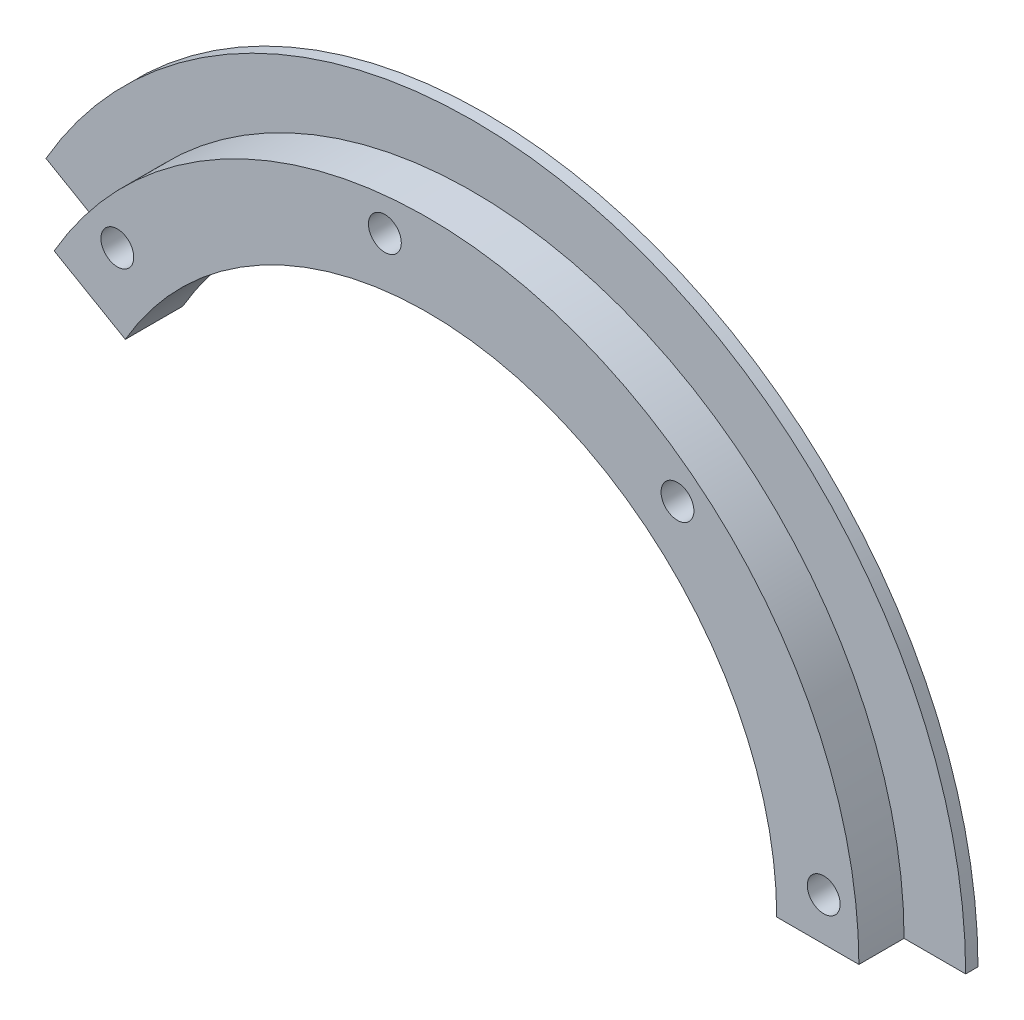
from build123d import *

# Parameters (mm, degrees)
SKETCH_1_R          = 2
EXTRUDE_1_DEPTH     = 7
CUT_EXTRUDE_START   = -5.5
CUT_EXTRUDE_1_DEPTH = 5.5


with BuildPart() as part:
    # 草图1 → 凸台-拉伸1 (new body)
    with BuildSketch(Plane.XY):
        with BuildLine():
            Line((42.5, 0), (60, 0))
            ThreePointArc((60, 0), (15.529142706, 57.955549577), (-51.961524227, 30))
            Line((-51.961524227, 30), (-36.806079661, 21.25))
            ThreePointArc((-36.806079661, 21.25), (10.999809417, 41.051847617), (42.5, 0))
        make_face()
        with Locations((48.219679614, 5.206966288)):
            Circle(SKETCH_1_R, mode=Mode.SUBTRACT)
        with Locations((-37.778343613, 30.41458127)):
            Circle(SKETCH_1_R, mode=Mode.SUBTRACT)
        with Locations((-5.206966288, 48.219679614)):
            Circle(SKETCH_1_R, mode=Mode.SUBTRACT)
        with Locations((30.41458127, 37.778343613)):
            Circle(SKETCH_1_R, mode=Mode.SUBTRACT)
    extrude(amount=EXTRUDE_1_DEPTH)

    # 草图2 → 切除-拉伸1 (cut)
    with BuildSketch(Plane.XY.offset(7).offset(CUT_EXTRUDE_START)):
        with BuildLine():
            Line((52.5, 0), (60, 0))
            ThreePointArc((60, 0), (15.529142706, 57.955549577), (-51.961524227, 30))
            Line((-51.961524227, 30), (-45.466333699, 26.25))
            ThreePointArc((-45.466333699, 26.25), (13.587999868, 50.71110588), (52.5, 0))
        make_face()
    extrude(amount=CUT_EXTRUDE_1_DEPTH, mode=Mode.SUBTRACT)


solid = part.part
